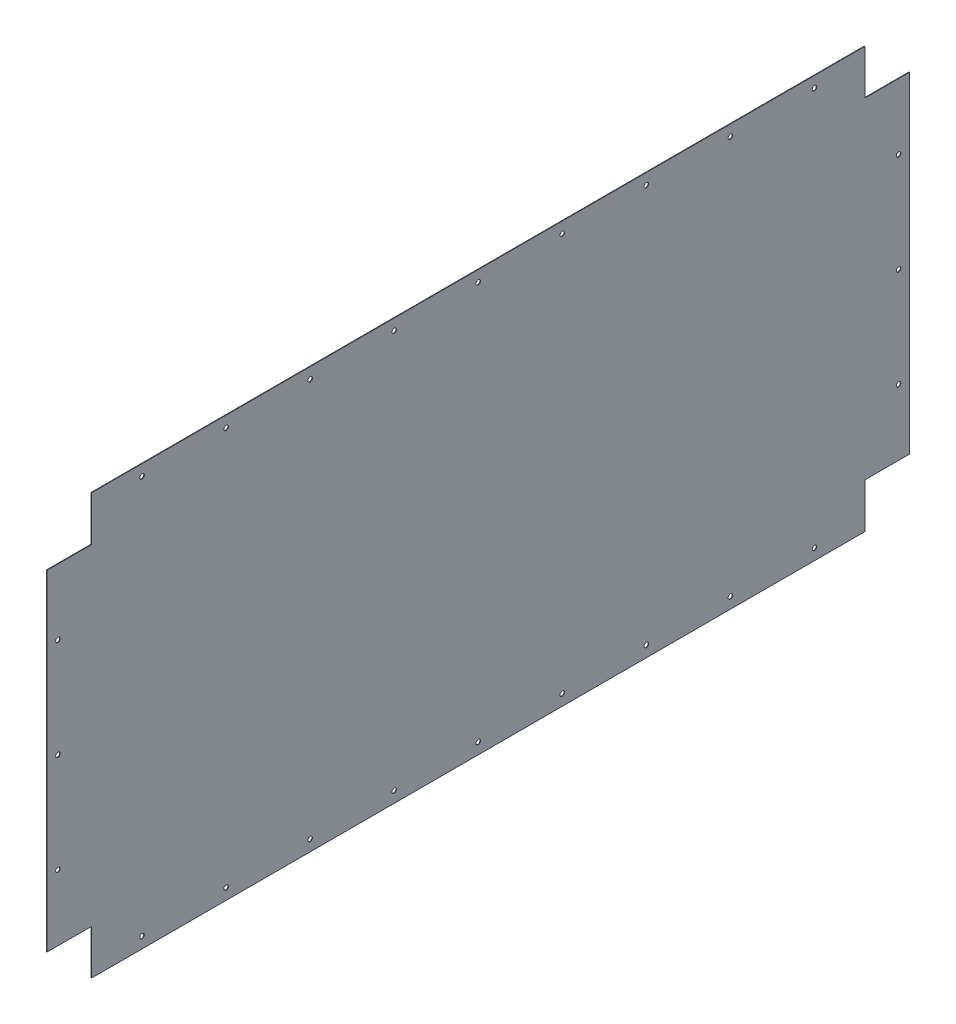
from build123d import *

# Parameters (mm, degrees)
SKETCH1_W               = 1559.92
SKETCH1_H               = 759.96
SKETCH1_R               = 4.1
BOSS_EXTRUDE1_DEPTH     = 1
CUT_EXTRUDE1_DEPTH      = 10
CUT_EXTRUDE1_DEPTH_BACK = 10
SKETCH2_W               = 81
SKETCH2_H               = 81


with BuildPart() as part:
    # Sketch1 → Boss-Extrude1 (new body)
    with BuildSketch(Plane(origin=(0, 0, 0), x_dir=(0, 0, -1), z_dir=(1, 0, 0))):
        Rectangle(SKETCH1_W, SKETCH1_H)
        with Locations((-759.96, 359.98)):
            Circle(SKETCH1_R, mode=Mode.SUBTRACT)
        with Locations((-759.96, -359.98)):
            Circle(SKETCH1_R, mode=Mode.SUBTRACT)
        with Locations((-607.97, 359.98)):
            Circle(SKETCH1_R, mode=Mode.SUBTRACT)
        with Locations((-607.97, -359.98)):
            Circle(SKETCH1_R, mode=Mode.SUBTRACT)
        with Locations((-455.98, 359.98)):
            Circle(SKETCH1_R, mode=Mode.SUBTRACT)
        with Locations((-455.98, -359.98)):
            Circle(SKETCH1_R, mode=Mode.SUBTRACT)
        with Locations((-303.99, 359.98)):
            Circle(SKETCH1_R, mode=Mode.SUBTRACT)
        with Locations((-303.99, -359.98)):
            Circle(SKETCH1_R, mode=Mode.SUBTRACT)
        with Locations((-152, 359.98)):
            Circle(SKETCH1_R, mode=Mode.SUBTRACT)
        with Locations((-152, -359.98)):
            Circle(SKETCH1_R, mode=Mode.SUBTRACT)
        with Locations((-0.01, 359.98)):
            Circle(SKETCH1_R, mode=Mode.SUBTRACT)
        with Locations((-0.01, -359.98)):
            Circle(SKETCH1_R, mode=Mode.SUBTRACT)
        with Locations((151.98, 359.98)):
            Circle(SKETCH1_R, mode=Mode.SUBTRACT)
        with Locations((151.98, -359.98)):
            Circle(SKETCH1_R, mode=Mode.SUBTRACT)
        with Locations((303.97, 359.98)):
            Circle(SKETCH1_R, mode=Mode.SUBTRACT)
        with Locations((303.97, -359.98)):
            Circle(SKETCH1_R, mode=Mode.SUBTRACT)
        with Locations((455.96, 359.98)):
            Circle(SKETCH1_R, mode=Mode.SUBTRACT)
        with Locations((455.96, -359.98)):
            Circle(SKETCH1_R, mode=Mode.SUBTRACT)
        with Locations((607.95, 359.98)):
            Circle(SKETCH1_R, mode=Mode.SUBTRACT)
        with Locations((607.95, -359.98)):
            Circle(SKETCH1_R, mode=Mode.SUBTRACT)
        with Locations((759.94, 359.98)):
            Circle(SKETCH1_R, mode=Mode.SUBTRACT)
        with Locations((759.94, -359.98)):
            Circle(SKETCH1_R, mode=Mode.SUBTRACT)
        with Locations((-759.96, 179.990000139)):
            Circle(SKETCH1_R, mode=Mode.SUBTRACT)
        with Locations((-759.96, 0)):
            Circle(SKETCH1_R, mode=Mode.SUBTRACT)
        with Locations((-759.96, -179.990000139)):
            Circle(SKETCH1_R, mode=Mode.SUBTRACT)
        with Locations((759.96, 0)):
            Circle(SKETCH1_R, mode=Mode.SUBTRACT)
        with Locations((759.96, 179.990000139)):
            Circle(SKETCH1_R, mode=Mode.SUBTRACT)
        with Locations((759.96, -179.990000139)):
            Circle(SKETCH1_R, mode=Mode.SUBTRACT)
    extrude(amount=BOSS_EXTRUDE1_DEPTH)

    # Sketch2 → Cut-Extrude1 (cut, two sides: drawn at the far end of the back side and taken through both)
    with BuildSketch(Plane(origin=(0, 0, 0), x_dir=(0, 0, -1), z_dir=(1, 0, 0)).offset(-CUT_EXTRUDE1_DEPTH_BACK)):
        with Locations((-739.46, 339.48)):
            Rectangle(SKETCH2_W, SKETCH2_H)
        with Locations((-739.46, -339.48)):
            Rectangle(SKETCH2_W, SKETCH2_H)
        with Locations((739.46, -339.48)):
            Rectangle(SKETCH2_W, SKETCH2_H)
        with Locations((739.46, 339.48)):
            Rectangle(SKETCH2_W, SKETCH2_H)
    extrude(amount=CUT_EXTRUDE1_DEPTH + CUT_EXTRUDE1_DEPTH_BACK, mode=Mode.SUBTRACT)


solid = part.part
